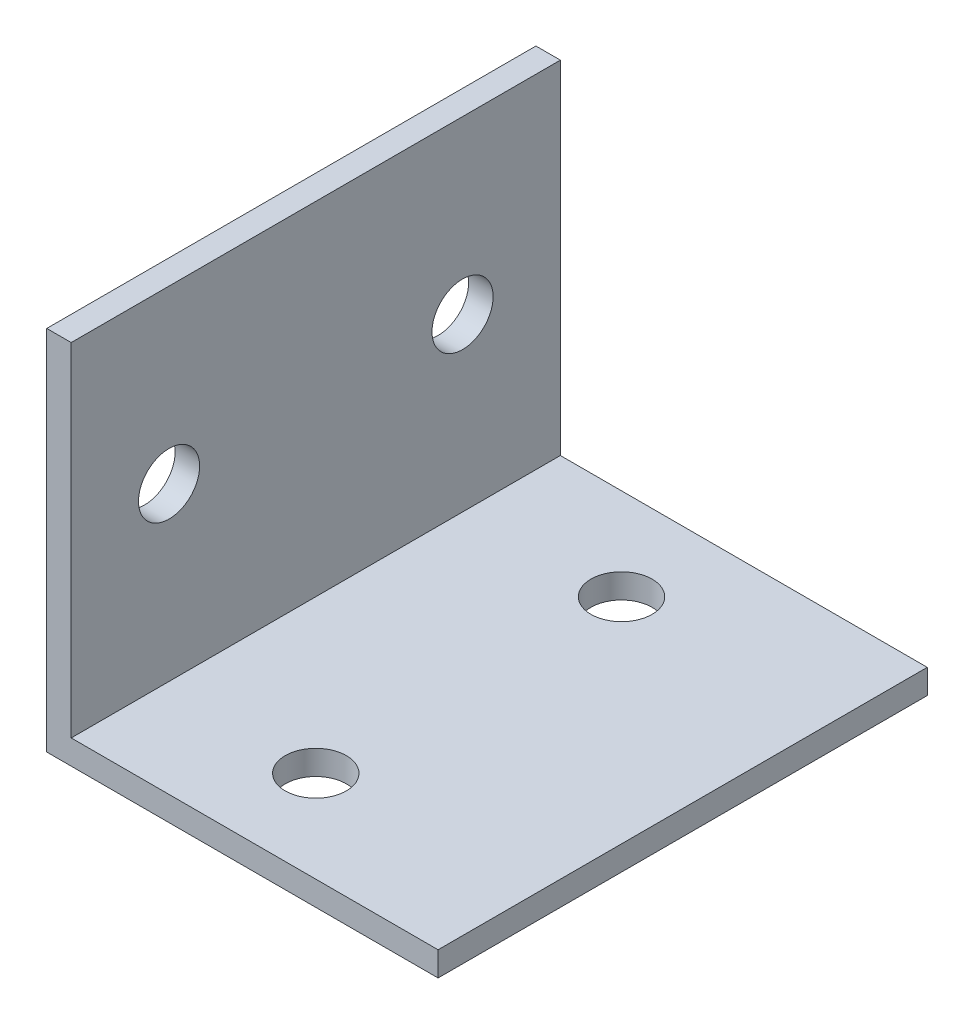
from build123d import *

# Parameters (mm, degrees)
BOSS_EXTRUDE1_DEPTH         = 40
TAP_DRILL_FOR_M6X1_0_TAP1_D = 5
TAP_DRILL_FOR_M6X1_0_TAP2_D = 5


with BuildPart() as part:
    # Sketch1 → Boss-Extrude1 (new body)
    with BuildSketch(Plane.XY):
        Polygon((0, 0), (0, -30), (32, -30), (32, -28), (2, -28), (2, 0), align=None)
    extrude(amount=BOSS_EXTRUDE1_DEPTH)

    # Tap Drill for M6x1.0 Tap1 (through all)
    with Locations(Plane(origin=(0, -28, 0), x_dir=(1, 0, 0), z_dir=(0, 1, 0))):
        with Locations((14.5, -7.5), (14.5, -32.5)):
            Hole(TAP_DRILL_FOR_M6X1_0_TAP1_D / 2)

    # Tap Drill for M6x1.0 Tap2 (through all)
    with Locations(Plane(origin=(2, 0, 0), x_dir=(0, 0, -1), z_dir=(1, 0, 0))):
        with Locations((-32, -14), (-8, -14)):
            Hole(TAP_DRILL_FOR_M6X1_0_TAP2_D / 2)


solid = part.part
